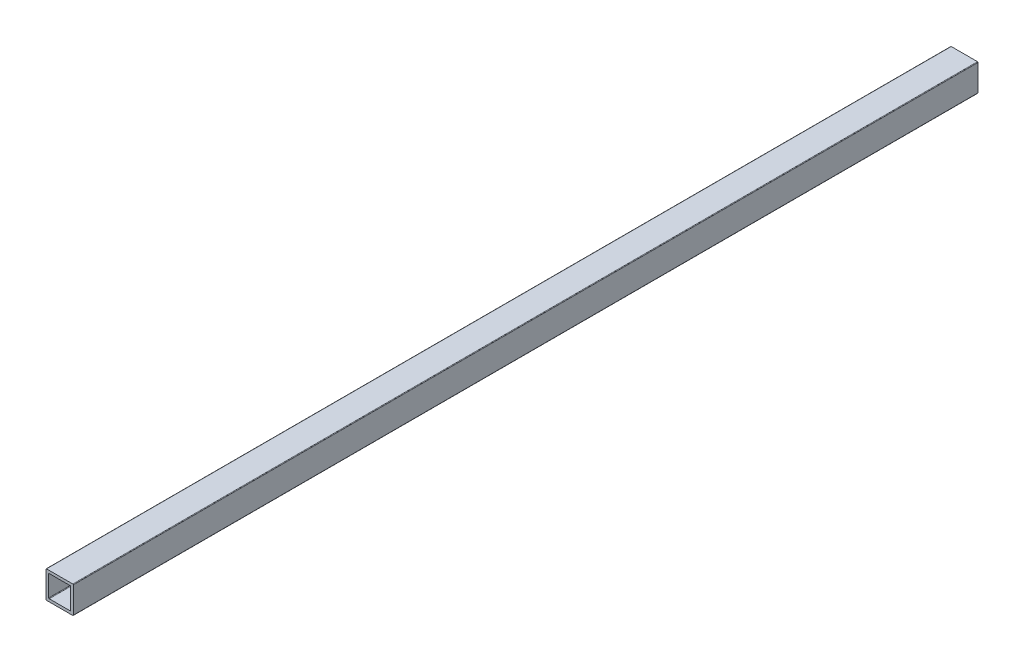
from build123d import *

# Parameters (mm, degrees)
SKETCH_1_W      = 10
SKETCH_1_H      = 10
SKETCH_1_W_2    = 8
SKETCH_1_H_2    = 8
EXTRUDE_1_DEPTH = 331.47
FILLET_1_R      = 0.2


with BuildPart() as part:
    # 草圖1 → 填料-伸長1 (new body)
    with BuildSketch(Plane.XY):
        Rectangle(SKETCH_1_W, SKETCH_1_H)
        Rectangle(SKETCH_1_W_2, SKETCH_1_H_2, mode=Mode.SUBTRACT)
    extrude(amount=EXTRUDE_1_DEPTH)

    # 圓角1
    fillet_1_edges = [part.edges().sort_by_distance(p)[0] for p in [
        (-4, 4, 165.735),
        (-4, -4, 165.735),
        (4, -4, 165.735),
        (4, 4, 165.735),
        (-5, 5, 165.735),
        (5, 5, 165.735),
        (5, -5, 165.735),
        (-5, -5, 165.735),
    ]]
    fillet(fillet_1_edges, radius=FILLET_1_R)


solid = part.part
